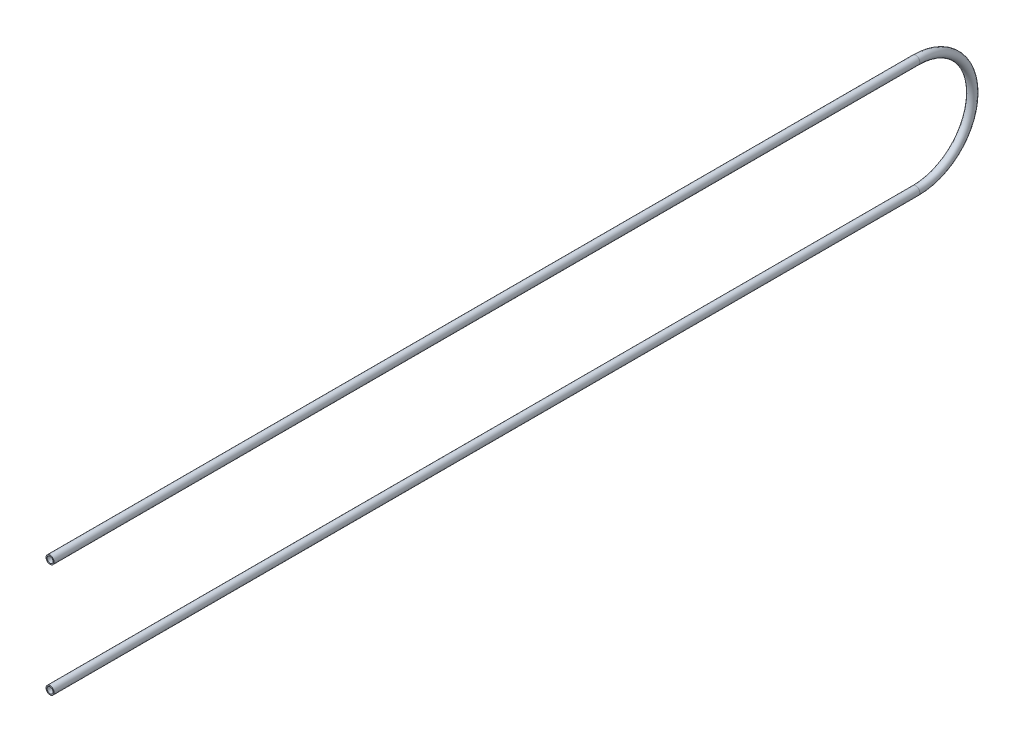
from build123d import *

# Parameters (mm, degrees)
SKETCH2_R   = 10.668
SKETCH2_R_2 = 7.8994


with BuildPart() as part:
    # Sweep1: sweep along a path in Sketch1
    with BuildLine(Plane(origin=(0, 0, 0), x_dir=(0, 0, -1), z_dir=(1, 0, 0))) as sweep1_path:
        Line((0, 149.225), (2286, 149.225))
        ThreePointArc((2286, 149.225), (2435.225, 0), (2286, -149.225))
        Line((2286, -149.225), (0, -149.225))
    # Sketch2 → Sweep1 (sweep)
    with BuildSketch(Plane.XY):
        with Locations((0, 149.225)):
            Circle(SKETCH2_R)
        with Locations((0, 149.225)):
            Circle(SKETCH2_R_2, mode=Mode.SUBTRACT)
    sweep(path=sweep1_path.line)


solid = part.part
